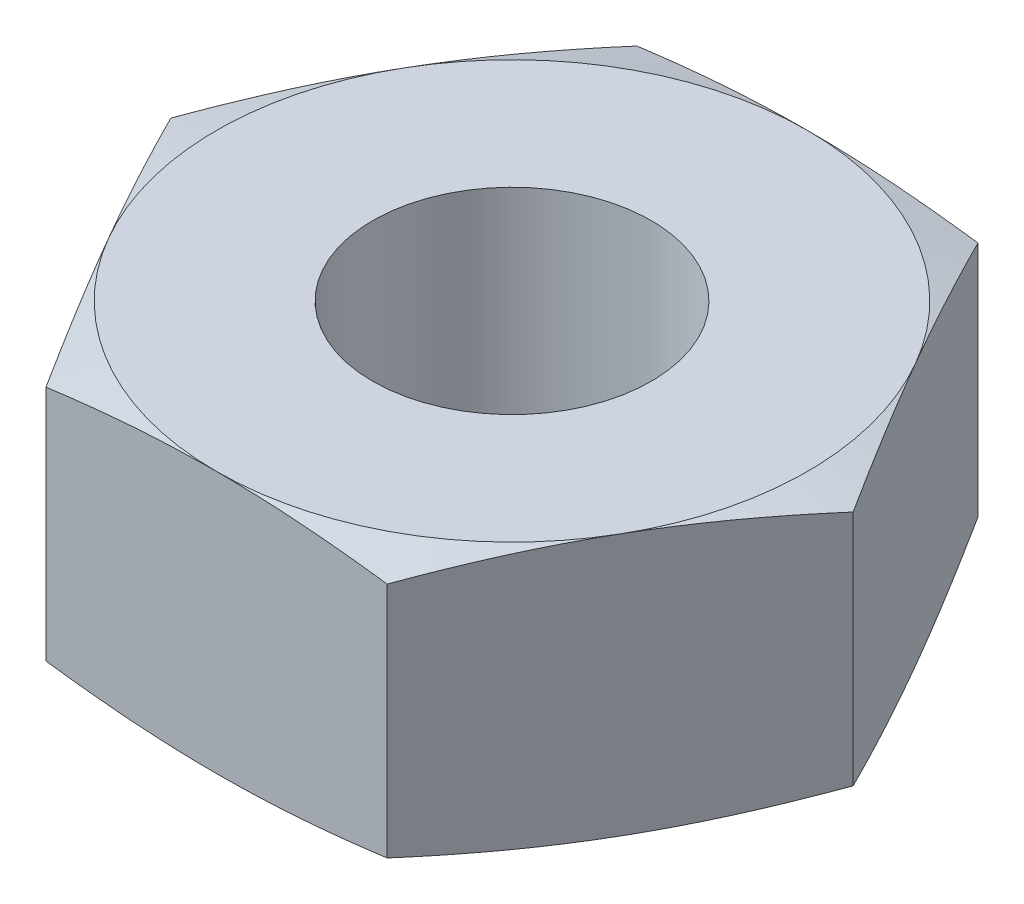
from build123d import *

# Parameters (mm, degrees)
EXTRUDE_1_DEPTH    = 3.1
HOLE_WIZARD_M4_1_D = 3.3


with BuildPart() as part:
    # 草图1 → 凸台-拉伸1 (new body)
    with BuildSketch(Plane(origin=(0, 0, 0), x_dir=(1, 0, 0), z_dir=(0, 1, 0))):
        Polygon((4.041451884, 0), (2.020725942, 3.5), (-2.020725942, 3.5), (-4.041451884, 0), (-2.020725942, -3.5), (2.020725942, -3.5), align=None)
    extrude(amount=EXTRUDE_1_DEPTH)

    # M4 螺纹孔1 (through all)
    with Locations(Plane(origin=(0, 3.1, 0), x_dir=(1, 0, 0), z_dir=(0, 1, 0))):
        with Locations((0, 0)):
            Hole(HOLE_WIZARD_M4_1_D / 2)

    # 草图5 → 切除-旋转1 (revolve, cut)
    with BuildSketch(Plane(origin=(0, 0, 0), x_dir=(0, 0, -1), z_dir=(1, 0, 0))):
        Polygon((-3.5, 0), (-4.387126804, 0.237704911), (-4.387126804, -0.855779568), align=None)
        Polygon((-4.387126804, 3.955779568), (-3.5, 3.1), (-4.387126804, 2.862295089), align=None)
    revolve(axis=Axis((0, 0, 0), (0, -1, 0)), mode=Mode.SUBTRACT)


solid = part.part
